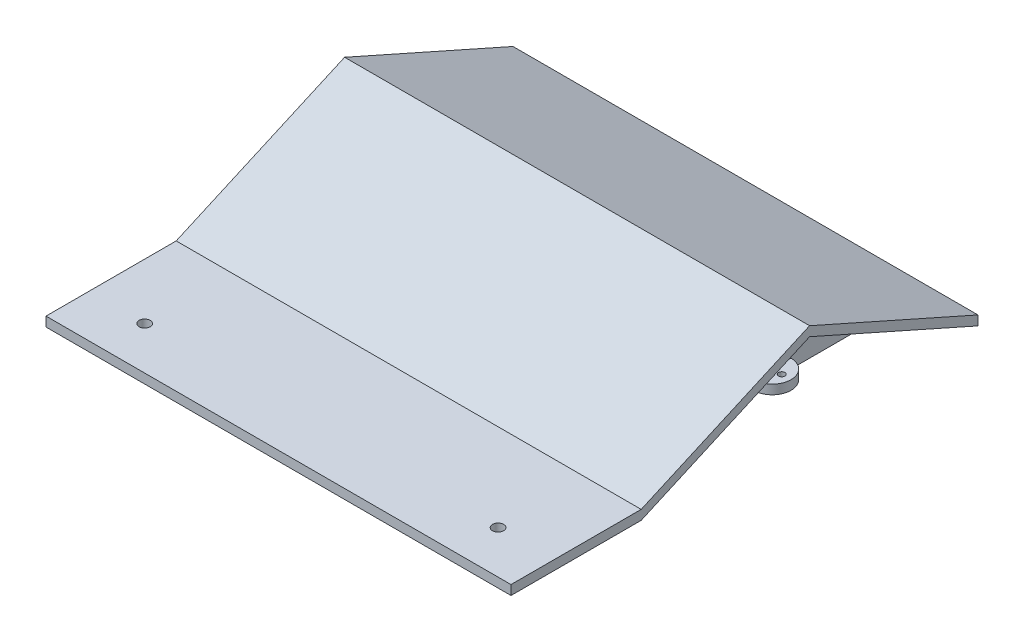
from build123d import *

# Parameters (mm, degrees)
BOSS_EXTRUDE1_DEPTH = 250
BOSS_EXTRUDE2_DEPTH = 25
CUT_EXTRUDE1_DEPTH  = 20
BOSS_EXTRUDE3_DEPTH = 25
CUT_EXTRUDE2_DEPTH  = 20
BOSS_EXTRUDE4_DEPTH = 5
BOSS_EXTRUDE5_DEPTH = 5
SKETCH8_R           = 1.5
CUT_EXTRUDE3_DEPTH  = 10
SKETCH9_W           = 70
SKETCH9_H           = 5.120472302
BOSS_EXTRUDE7_DEPTH = 250
SKETCH11_R          = 3
CUT_EXTRUDE4_DEPTH  = 10


with BuildPart() as part:
    # Sketch1 → Boss-Extrude1 (new body)
    with BuildSketch(Plane(origin=(0, 0, 0), x_dir=(0, 0, -1), z_dir=(1, 0, 0))):
        Polygon((-23.04212536, -5.120472302), (67.5, 35.120472302), (158.04212536, -5.120472302), (158.04212536, -10.240944604), (135, 0), (67.5, 30), (0, 0), (-23.04212536, -10.240944604), align=None)
    extrude(amount=-BOSS_EXTRUDE1_DEPTH)

    # Sketch2 → Boss-Extrude2 (add)
    with BuildSketch(Plane(origin=(0, 0, 0), x_dir=(0, 0, -1), z_dir=(1, 0, 0))):
        Polygon((0, 0), (135, 0), (67.5, 30), align=None)
    extrude(amount=-BOSS_EXTRUDE2_DEPTH)

    # Sketch3 → Cut-Extrude1 (cut)
    with BuildSketch(Plane(origin=(0, 0, 0), x_dir=(0, 0, -1), z_dir=(1, 0, 0))):
        Polygon((0, 0), (135, 0), (67.5, 30), align=None)
    extrude(amount=-CUT_EXTRUDE1_DEPTH, mode=Mode.SUBTRACT)

    # Sketch4 → Boss-Extrude3 (add)
    with BuildSketch(Plane.ZY.offset(250)):
        Polygon((-135, 0), (0, 0), (-67.5, 30), align=None)
    extrude(amount=-BOSS_EXTRUDE3_DEPTH)

    # Sketch5 → Cut-Extrude2 (cut)
    with BuildSketch(Plane.ZY.offset(250)):
        Polygon((-135, 0), (0, 0), (-67.5, 29.582678365), align=None)
    extrude(amount=-CUT_EXTRUDE2_DEPTH, mode=Mode.SUBTRACT)

    # Sketch6 → Boss-Extrude4 (add)
    with BuildSketch(Plane(origin=(0, 0, 0), x_dir=(-1, 0, 0), z_dir=(0, -1, 0))):
        with BuildLine():
            ThreePointArc((233.3, 67.5), (235, 69.2), (236.7, 67.5))
            Line((236.7, 67.5), (240, 67.5))
            ThreePointArc((240, 67.5), (237.071067812, 74.571067812), (230, 77.5))
            Line((230, 77.5), (230, 67.5))
            Line((230, 67.5), (233.3, 67.5))
        make_face()
        with BuildLine():
            Line((240, 67.5), (236.7, 67.5))
            ThreePointArc((236.7, 67.5), (235, 65.8), (233.3, 67.5))
            Line((233.3, 67.5), (230, 67.5))
            Line((230, 67.5), (230, 57.5))
            ThreePointArc((230, 57.5), (237.071067812, 60.428932188), (240, 67.5))
        make_face()
        with BuildLine():
            Line((225, 58.839745962), (225, 76.160254038))
            ThreePointArc((225, 76.160254038), (220, 67.5), (225, 58.839745962))
        make_face()
        with BuildLine():
            Line((230, 67.5), (230, 77.5))
            ThreePointArc((230, 77.5), (227.411809549, 77.159258263), (225, 76.160254038))
            Line((225, 76.160254038), (225, 58.839745962))
            ThreePointArc((225, 58.839745962), (227.411809549, 57.840741737), (230, 57.5))
            Line((230, 57.5), (230, 67.5))
        make_face()
    extrude(amount=-BOSS_EXTRUDE4_DEPTH)

    # Sketch7 → Boss-Extrude5 (add)
    with BuildSketch(Plane(origin=(0, 0, 0), x_dir=(-1, 0, 0), z_dir=(0, -1, 0))):
        with BuildLine():
            Line((20, 57.5), (20, 67.5))
            Line((20, 67.5), (16.7, 67.5))
            ThreePointArc((16.7, 67.5), (15, 65.8), (13.3, 67.5))
            Line((13.3, 67.5), (10, 67.5))
            ThreePointArc((10, 67.5), (12.928932188, 60.428932188), (20, 57.5))
        make_face()
        with BuildLine():
            Line((16.7, 67.5), (20, 67.5))
            Line((20, 67.5), (20, 77.5))
            ThreePointArc((20, 77.5), (12.928932188, 74.571067812), (10, 67.5))
            Line((10, 67.5), (13.3, 67.5))
            ThreePointArc((13.3, 67.5), (15, 69.2), (16.7, 67.5))
        make_face()
        with BuildLine():
            Line((20, 77.5), (20, 67.5))
            Line((20, 67.5), (20, 57.5))
            ThreePointArc((20, 57.5), (22.588190451, 57.840741737), (25, 58.839745962))
            Line((25, 58.839745962), (25, 76.160254038))
            ThreePointArc((25, 76.160254038), (22.588190451, 77.159258263), (20, 77.5))
        make_face()
        with BuildLine():
            ThreePointArc((30, 67.5), (28.660254038, 72.5), (25, 76.160254038))
            Line((25, 76.160254038), (25, 58.839745962))
            ThreePointArc((25, 58.839745962), (28.660254038, 62.5), (30, 67.5))
        make_face()
    extrude(amount=-BOSS_EXTRUDE5_DEPTH)

    # Sketch8 → Cut-Extrude3 (cut)
    with BuildSketch(Plane.ZY.offset(230)):
        with Locations((-67.5, 25)):
            Circle(SKETCH8_R)
    extrude(amount=-CUT_EXTRUDE3_DEPTH, mode=Mode.SUBTRACT)

    # Sketch9 → Boss-Extrude7 (add)
    with BuildSketch(Plane.ZY.offset(250)):
        with Locations((58.04212536, -7.680708453)):
            Rectangle(SKETCH9_W, SKETCH9_H)
    extrude(amount=-BOSS_EXTRUDE7_DEPTH)

    # Sketch11 → Cut-Extrude4 (cut)
    with BuildSketch(Plane(origin=(0, -5.120472302, 0), x_dir=(1, 0, 0), z_dir=(0, 1, 0))):
        with Locations(Location((-220, -70, 0), (0, 0, 270))):
            Circle(SKETCH11_R)
        with Locations(Location((-30, -70, 0), (0, 0, 270))):
            Circle(SKETCH11_R)
    extrude(amount=-CUT_EXTRUDE4_DEPTH, mode=Mode.SUBTRACT)


solid = part.part
